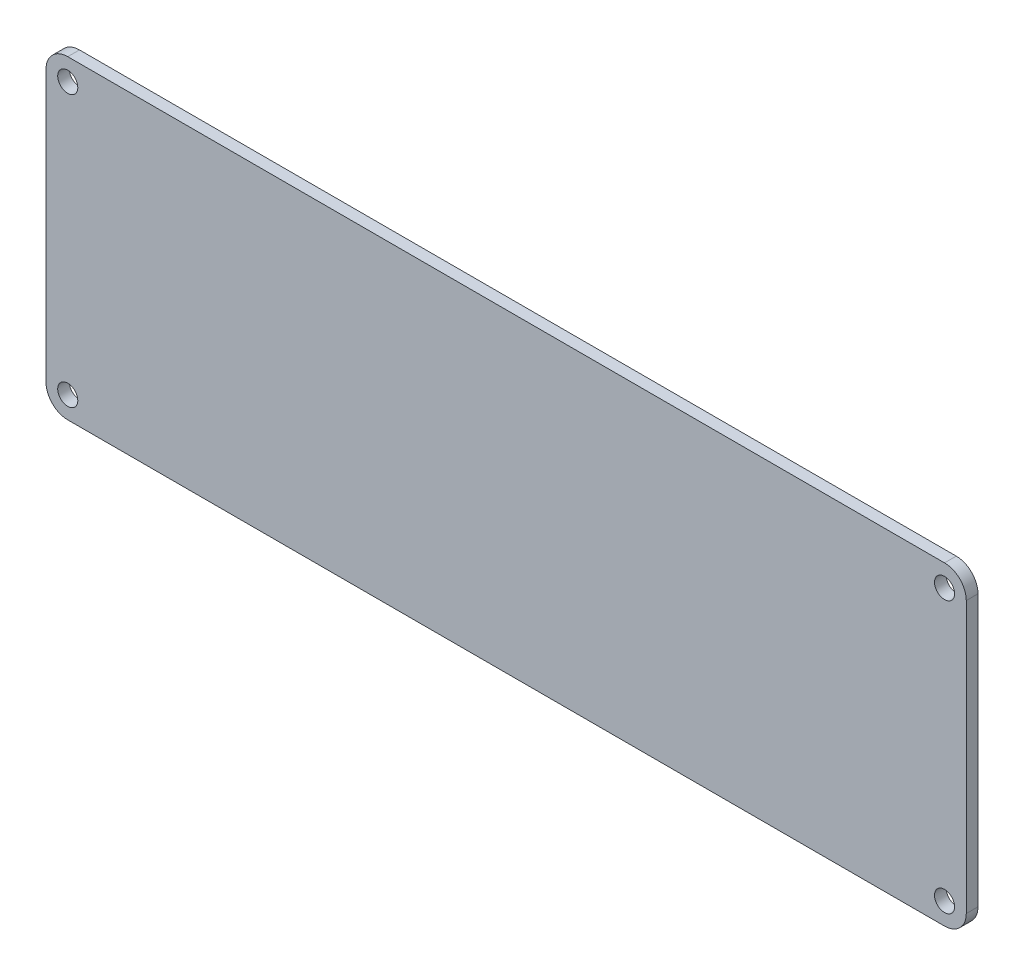
from build123d import *

# Parameters (mm, degrees)
SKETCH_1_R      = 1.524
EXTRUDE_1_DEPTH = 1.778


with BuildPart() as part:
    # 草图1 → 凸台-拉伸1 (new body)
    with BuildSketch(Plane.XY):
        with BuildLine():
            Line((3.302, 0), (136.398, 0))
            ThreePointArc((136.398, 0), (138.732866591, 0.967133409), (139.7, 3.302))
            Line((139.7, 3.302), (139.7, 44.45))
            ThreePointArc((139.7, 44.45), (138.732866591, 46.784866591), (136.398, 47.752))
            Line((136.398, 47.752), (3.302, 47.752))
            ThreePointArc((3.302, 47.752), (0.967133409, 46.784866591), (0, 44.45))
            Line((0, 44.45), (0, 3.302))
            ThreePointArc((0, 3.302), (0.967133409, 0.967133409), (3.302, 0))
        make_face()
        with Locations((3.302, 44.45)):
            Circle(SKETCH_1_R, mode=Mode.SUBTRACT)
        with Locations((136.398, 44.45)):
            Circle(SKETCH_1_R, mode=Mode.SUBTRACT)
        with Locations((136.398, 3.302)):
            Circle(SKETCH_1_R, mode=Mode.SUBTRACT)
        with Locations((3.302, 3.302)):
            Circle(SKETCH_1_R, mode=Mode.SUBTRACT)
    extrude(amount=EXTRUDE_1_DEPTH)


solid = part.part
